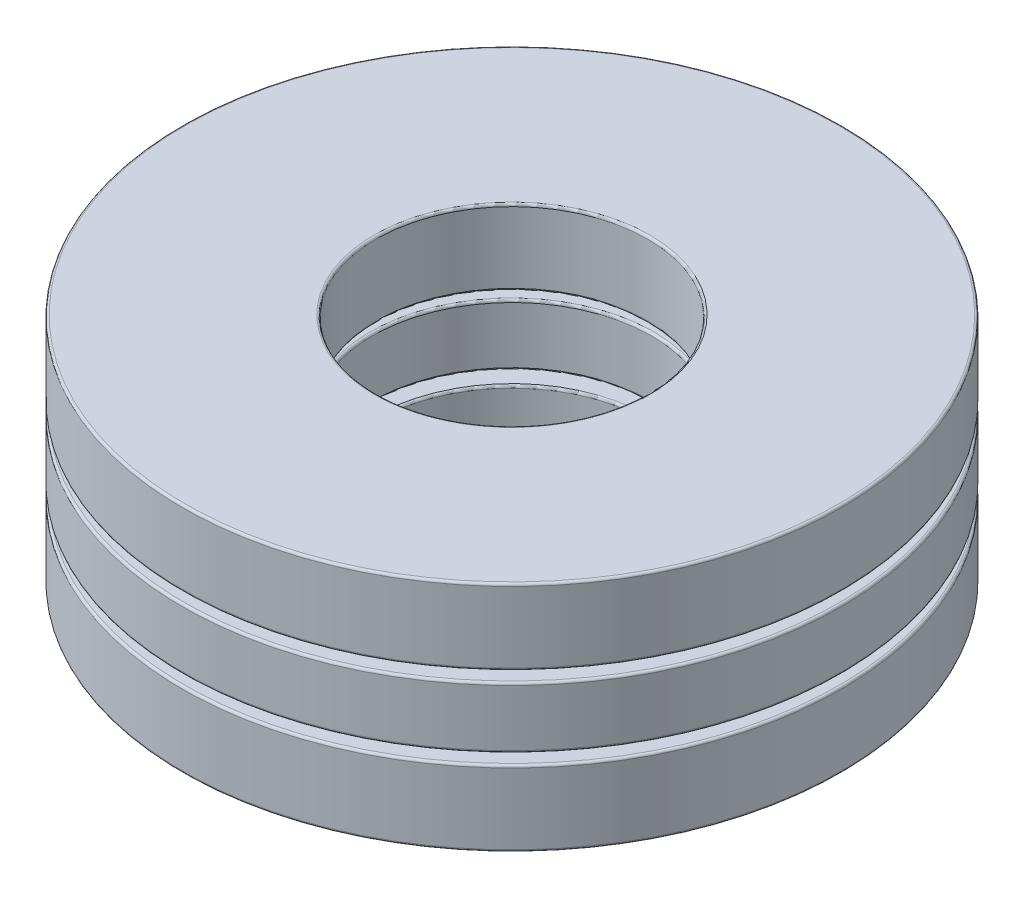
from build123d import *

# Parameters (mm, degrees)
CIRPATTERN2_COUNT = 4
CIRPATTERN3_COUNT = 4


with BuildPart() as part:
    # Sketch2 → Revolve2 (revolve)
    with BuildSketch(Plane.XY):
        with BuildLine():
            Line((-3.6, -0.7275), (-3.6, 0.7275))
            ThreePointArc((-3.6, 0.7275), (-3.617573593, 0.769926407), (-3.66, 0.7875))
            Line((-3.66, 0.7875), (-8.44, 0.7875))
            ThreePointArc((-8.44, 0.7875), (-8.482426407, 0.769926407), (-8.5, 0.7275))
            Line((-8.5, 0.7275), (-8.5, -0.7275))
            ThreePointArc((-8.5, -0.7275), (-8.482426407, -0.769926407), (-8.44, -0.7875))
            Line((-8.44, -0.7875), (-3.66, -0.7875))
            ThreePointArc((-3.66, -0.7875), (-3.617573593, -0.769926407), (-3.6, -0.7275))
        make_face()
    revolve(axis=Axis((0, -3, 0), (0, 1, 0)))

    # Sketch3 → Cut-Revolve1 (revolve, cut)
    with BuildSketch(Plane.XY):
        with BuildLine():
            Line((-6.375, 1.3225), (-6.375, -1.3225))
            ThreePointArc((-6.375, -1.3225), (-7.6975, 0), (-6.375, 1.3225))
        make_face()
    cut_revolve1 = revolve(axis=Axis((-6.375, 1.3225, 0), (0, -1, 0)), mode=Mode.SUBTRACT)

    # CirPattern2: Cut-Revolve1 ×4 about axis
    cirpattern2_axis = Axis((0, -3, 0), (0, 1, 0))
    for i in range(1, CIRPATTERN2_COUNT):
        add(cut_revolve1.rotate(cirpattern2_axis, i * 360 / CIRPATTERN2_COUNT), mode=Mode.SUBTRACT)


with BuildPart() as body_2:
    # Sketch4 → Revolve3 (revolve)
    with BuildSketch(Plane.XY):
        with BuildLine():
            Line((-8.44, 1.055), (-7.172484326, 1.055))
            ThreePointArc((-7.172484326, 1.055), (-6.375, 1.3225), (-5.577515674, 1.055))
            Line((-5.577515674, 1.055), (-3.56, 1.055))
            ThreePointArc((-3.56, 1.055), (-3.517573593, 1.072573593), (-3.5, 1.115))
            Line((-3.5, 1.115), (-3.5, 2.94))
            ThreePointArc((-3.5, 2.94), (-3.517573593, 2.982426407), (-3.56, 3))
            Line((-3.56, 3), (-8.44, 3))
            ThreePointArc((-8.44, 3), (-8.482426407, 2.982426407), (-8.5, 2.94))
            Line((-8.5, 2.94), (-8.5, 1.115))
            ThreePointArc((-8.5, 1.115), (-8.482426407, 1.072573593), (-8.44, 1.055))
        make_face()
    revolve(axis=Axis((0, -3, 0), (0, 1, 0)))


with BuildPart() as body_3:
    # Mirror1: mirrored copy
    add(body_2.part.mirror(Plane.ZX))


with BuildPart() as body_4:
    # Sketch5 → Revolve4 (revolve)
    with BuildSketch(Plane.XY):
        with BuildLine():
            Line((-6.375, 1.26), (-6.375, -1.26))
            ThreePointArc((-6.375, -1.26), (-7.635, 0), (-6.375, 1.26))
        make_face()
    revolve(axis=Axis((-6.375, 1.26, 0), (0, -1, 0)))


with BuildPart() as cirpattern3_1:
    # CirPattern3: pattern copy
    add(body_4.part.rotate(Axis((0, -3, 0), (0, 1, 0)), 1 * 360 / CIRPATTERN3_COUNT))


with BuildPart() as cirpattern3_2:
    # CirPattern3: pattern copy
    add(body_4.part.rotate(Axis((0, -3, 0), (0, 1, 0)), 2 * 360 / CIRPATTERN3_COUNT))


with BuildPart() as cirpattern3_3:
    # CirPattern3: pattern copy
    add(body_4.part.rotate(Axis((0, -3, 0), (0, 1, 0)), 3 * 360 / CIRPATTERN3_COUNT))


solid = Compound([part.part, body_2.part, body_3.part, body_4.part, cirpattern3_1.part, cirpattern3_2.part, cirpattern3_3.part])
